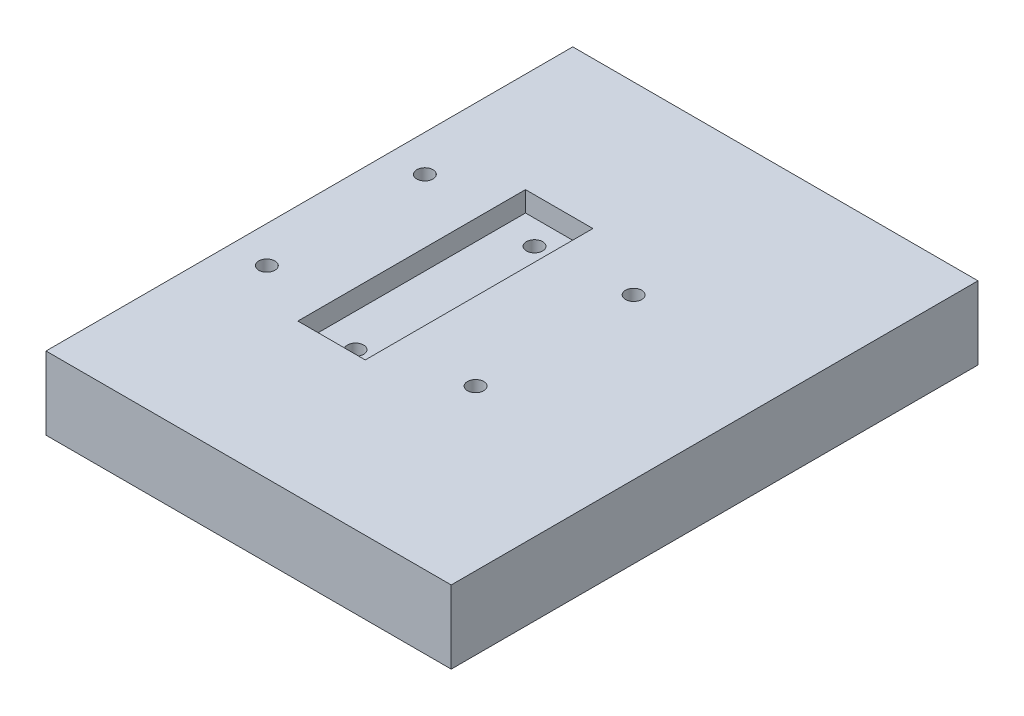
from build123d import *

# Parameters (mm, degrees)
ESQUISSE1_W             = 100
ESQUISSE1_H             = 130
BOSS_EXTRU_1_DEPTH      = 18
ESQUISSE2_R             = 2
ENL_V_MAT_EXTRU_1_DEPTH = 204.467720042
ESQUISSE3_R             = 2
ENL_V_MAT_EXTRU_2_DEPTH = 204.467720042
ESQUISSE6_W             = 16.632413999
ESQUISSE6_H             = 56.175813279
ENL_V_MAT_EXTRU_5_DEPTH = 5
ESQUISSE8_R             = 2
ENL_V_MAT_EXTRU_6_DEPTH = 3


with BuildPart() as part:
    # Esquisse1 → Boss.-Extru.1 (new body)
    with BuildSketch(Plane(origin=(0, 0, 0), x_dir=(1, 0, 0), z_dir=(0, 1, 0))):
        with Locations((-99.482451284, -71.857991573)):
            Rectangle(ESQUISSE1_W, ESQUISSE1_H)
    extrude(amount=BOSS_EXTRU_1_DEPTH)

    # Esquisse2 → Enlèv. mat.-Extru.1 (cut, through all)
    with BuildSketch(Plane(origin=(0, 18, 0), x_dir=(1, 0, 0), z_dir=(0, 1, 0))):
        with Locations(Location((-116.573423844, -93.378684857, 0), (0, 0, 270))):
            Circle(ESQUISSE2_R)
    extrude(amount=-ENL_V_MAT_EXTRU_1_DEPTH, mode=Mode.SUBTRACT)

    # Esquisse3 → Enlèv. mat.-Extru.2 (cut, through all)
    with BuildSketch(Plane.XZ):
        with Locations(Location((-88.966331324, 52.357991573, 0), (0, 0, 270))):
            Circle(ESQUISSE3_R)
        with Locations(Location((-88.966331324, 91.357991573, 0), (0, 0, 270))):
            Circle(ESQUISSE3_R)
        with Locations(Location((-140.482451284, 91.357991573, 0), (0, 0, 270))):
            Circle(ESQUISSE3_R)
        with Locations(Location((-140.482451284, 52.357991573, 0), (0, 0, 270))):
            Circle(ESQUISSE3_R)
    extrude(amount=-ENL_V_MAT_EXTRU_2_DEPTH, mode=Mode.SUBTRACT)

    # Esquisse6 → Enlèv. mat.-Extru.5 (cut)
    with BuildSketch(Plane(origin=(0, 18, 0), x_dir=(1, 0, 0), z_dir=(0, 1, 0))):
        with Locations((-116.487794331, -71.290778218)):
            Rectangle(ESQUISSE6_W, ESQUISSE6_H)
    extrude(amount=-ENL_V_MAT_EXTRU_5_DEPTH, mode=Mode.SUBTRACT)

    # Esquisse8 → Enlèv. mat.-Extru.6 (cut)
    with BuildSketch(Plane(origin=(0, 13, 0), x_dir=(1, 0, 0), z_dir=(0, 1, 0))):
        with Locations(Location((-116.573423844, -49.202871578, 0), (0, 0, 270))):
            Circle(ESQUISSE8_R)
    extrude(amount=-ENL_V_MAT_EXTRU_6_DEPTH, mode=Mode.SUBTRACT)


solid = part.part
